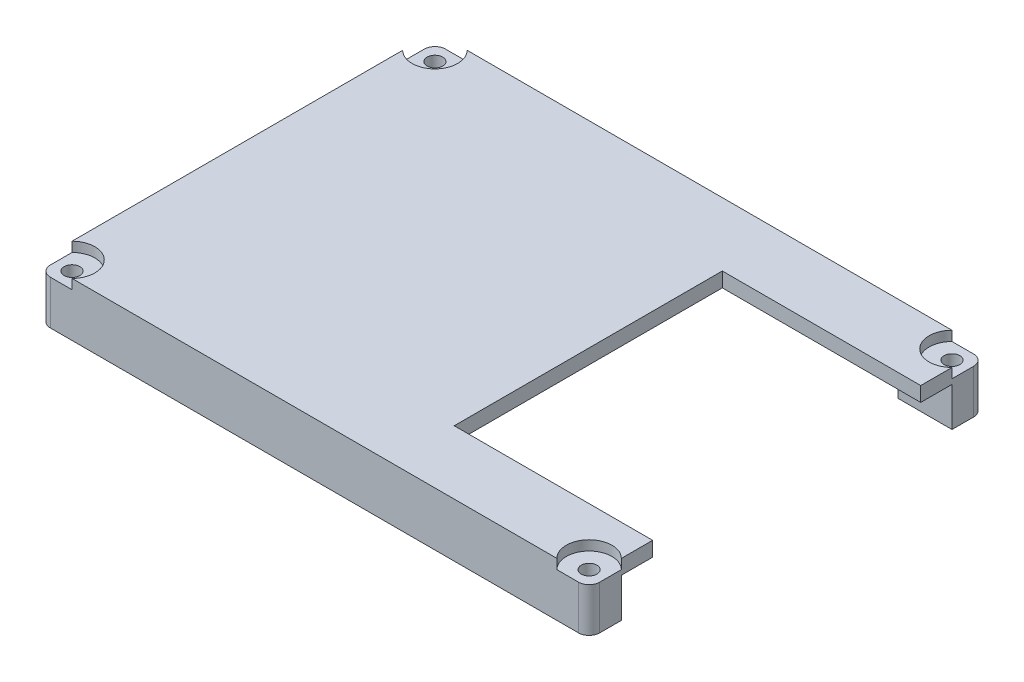
from build123d import *

# Parameters (mm, degrees)
EXTRUDE_1_DEPTH     = 4
SKETCH_2_W          = 1.5
SKETCH_2_H          = 40.43
EXTRUDE_2_DEPTH     = 1.5
SKETCH_3_W          = 40.43
SKETCH_3_H          = 1.5
EXTRUDE_5_DEPTH     = 54.71
SKETCH_4_W          = 40.43
SKETCH_4_H          = 1.5
CUT_EXTRUDE_1_DEPTH = 20.3
SKETCH_5_W          = 6.5
SKETCH_5_H          = 1.5
EXTRUDE_6_DEPTH     = 20.3
SKETCH_6_R          = 0.8
CUT_EXTRUDE_2_DEPTH = 20.3
SKETCH_7_R          = 2.333452378
CUT_EXTRUDE_5_DEPTH = 1
CUT_EXTRUDE_6_DEPTH = 10


with BuildPart() as part:
    # 草图1 → 凸台-拉伸1 (new body)
    with BuildSketch(Plane(origin=(0, 0, 0), x_dir=(1, 0, 0), z_dir=(0, 1, 0))):
        Polygon((-13.121987947, 19.52916985), (-7.621987947, 19.52916985), (-7.621987947, 22.82916985), (-63.831987947, 22.82916985), (-63.831987947, -17.60083015), (-7.621987947, -17.60083015), (-7.621987947, -14.30083015), (-13.121987947, -14.30083015), (-13.121987947, -16.10083015), (-60.331987947, -16.10083015), (-60.331987947, -14.30083015), (-62.331987947, -14.30083015), (-62.331987947, 19.52916985), (-60.331987947, 19.52916985), (-60.331987947, 21.32916985), (-13.121987947, 21.32916985), align=None)
    extrude(amount=EXTRUDE_1_DEPTH)

    # 草图2 → 凸台-拉伸2 (add)
    with BuildSketch(Plane(origin=(0, 4, 0), x_dir=(1, 0, 0), z_dir=(0, 1, 0))):
        with Locations((-63.081987947, 2.61416985)):
            Rectangle(SKETCH_2_W, SKETCH_2_H)
    extrude(amount=EXTRUDE_2_DEPTH)

    # 草图3 → 凸台-拉伸5 (add)
    with BuildSketch(Plane(origin=(-62.331987947, 0, 0), x_dir=(0, 0, -1), z_dir=(1, 0, 0))):
        with Locations((2.61416985, 4.75)):
            Rectangle(SKETCH_3_W, SKETCH_3_H)
    extrude(amount=EXTRUDE_5_DEPTH)

    # 草图4 → 切除-拉伸1 (cut)
    with BuildSketch(Plane(origin=(-7.621987947, 0, 0), x_dir=(0, 0, -1), z_dir=(1, 0, 0))):
        with Locations((2.61416985, 4.75)):
            Rectangle(SKETCH_4_W, SKETCH_4_H)
    extrude(amount=-CUT_EXTRUDE_1_DEPTH, mode=Mode.SUBTRACT)

    # 草图5 → 凸台-拉伸6 (add)
    with BuildSketch(Plane(origin=(-27.921987947, 0, 0), x_dir=(0, 0, -1), z_dir=(1, 0, 0))):
        with Locations((-14.35083015, 4.75)):
            Rectangle(SKETCH_5_W, SKETCH_5_H)
        with Locations((19.57916985, 4.75)):
            Rectangle(SKETCH_5_W, SKETCH_5_H)
    extrude(amount=EXTRUDE_6_DEPTH)

    # 草图6 → 切除-拉伸2 (cut)
    with BuildSketch(Plane.XZ):
        with Locations(Location((-9.271987947, -21.17916985, 0), (0, 0, 270))):
            Circle(SKETCH_6_R)
        with Locations(Location((-9.271987947, 15.95083015, 0), (0, 0, 270))):
            Circle(SKETCH_6_R)
        with Locations(Location((-62.181987947, 15.95083015, 0), (0, 0, 270))):
            Circle(SKETCH_6_R)
        with Locations(Location((-62.181987947, -21.17916985, 0), (0, 0, 270))):
            Circle(SKETCH_6_R)
    extrude(amount=-CUT_EXTRUDE_2_DEPTH, mode=Mode.SUBTRACT)

    # 草图7 → 切除-拉伸5 (cut)
    with BuildSketch(Plane(origin=(0, 5.5, 0), x_dir=(1, 0, 0), z_dir=(0, 1, 0))):
        with Locations((-62.181987947, -15.95083015)):
            Circle(SKETCH_7_R)
        with Locations((-62.181987947, 21.17916985)):
            Circle(SKETCH_7_R)
        with Locations((-9.271987947, 21.17916985)):
            Circle(SKETCH_7_R)
        with Locations((-9.271987947, -15.95083015)):
            Circle(SKETCH_7_R)
    extrude(amount=-CUT_EXTRUDE_5_DEPTH, mode=Mode.SUBTRACT)

    # 草图9 → 切除-拉伸6 (cut)
    with BuildSketch(Plane.XZ):
        with BuildLine():
            Line((-62.747673372, -22.82916985), (-63.831987947, -22.82916985))
            Line((-63.831987947, -22.82916985), (-63.831987947, -21.744855275))
            ThreePointArc((-63.831987947, -21.744855275), (-63.514399561, -22.511581464), (-62.747673372, -22.82916985))
        make_face()
        with BuildLine():
            Line((-62.747673372, 17.60083015), (-63.831987947, 17.60083015))
            Line((-63.831987947, 17.60083015), (-63.831987947, 16.516515575))
            ThreePointArc((-63.831987947, 16.516515575), (-63.514399561, 17.283241764), (-62.747673372, 17.60083015))
        make_face()
        with BuildLine():
            Line((-7.621987947, 16.516515575), (-7.621987947, 17.60083015))
            Line((-7.621987947, 17.60083015), (-8.706302522, 17.60083015))
            ThreePointArc((-8.706302522, 17.60083015), (-7.939576333, 17.283241764), (-7.621987947, 16.516515575))
        make_face()
        with BuildLine():
            Line((-7.621987947, -21.744855275), (-7.621987947, -22.82916985))
            Line((-7.621987947, -22.82916985), (-8.706302522, -22.82916985))
            ThreePointArc((-8.706302522, -22.82916985), (-7.939576333, -22.511581464), (-7.621987947, -21.744855275))
        make_face()
    extrude(amount=-CUT_EXTRUDE_6_DEPTH, mode=Mode.SUBTRACT)


solid = part.part
